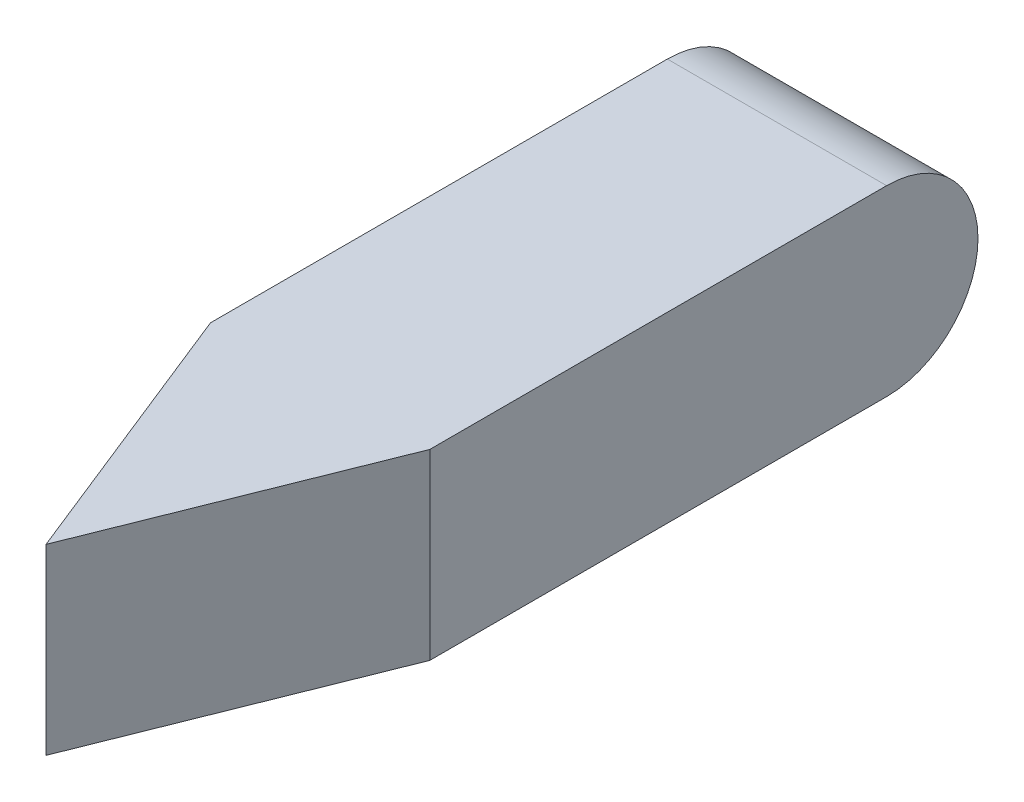
from build123d import *

# Parameters (mm, degrees)
SKETCH_2_W          = 12
SKETCH_2_H          = 10
EXTRUDE_1_DEPTH     = 45
CUT_EXTRUDE_1_DEPTH = 65
CUT_EXTRUDE_2_DEPTH = 65


with BuildPart() as part:
    # 草图2 → 凸台-拉伸1 (new body)
    with BuildSketch(Plane.XY):
        with Locations((6, 5)):
            Rectangle(SKETCH_2_W, SKETCH_2_H)
    extrude(amount=EXTRUDE_1_DEPTH)

    # 草图3 → 切除-拉伸1 (cut)
    with BuildSketch(Plane(origin=(12, 0, 0), x_dir=(0, 0, -1), z_dir=(1, 0, 0))):
        with BuildLine():
            Line((0, 0), (0, 5))
            ThreePointArc((0, 5), (-1.464466094, 1.464466094), (-5, 0))
            Line((-5, 0), (0, 0))
        make_face()
        with BuildLine():
            Line((0, 10), (-5, 10))
            ThreePointArc((-5, 10), (-1.464466094, 8.535533906), (0, 5))
            Line((0, 5), (0, 10))
        make_face()
    extrude(amount=-CUT_EXTRUDE_1_DEPTH, mode=Mode.SUBTRACT)

    # 草图4 → 切除-拉伸2 (cut)
    with BuildSketch(Plane.XZ):
        Polygon((0, 45), (0, 30), (6, 45), align=None)
        Polygon((12, 45), (6, 45), (12, 30), align=None)
    extrude(amount=-CUT_EXTRUDE_2_DEPTH, mode=Mode.SUBTRACT)


solid = part.part
